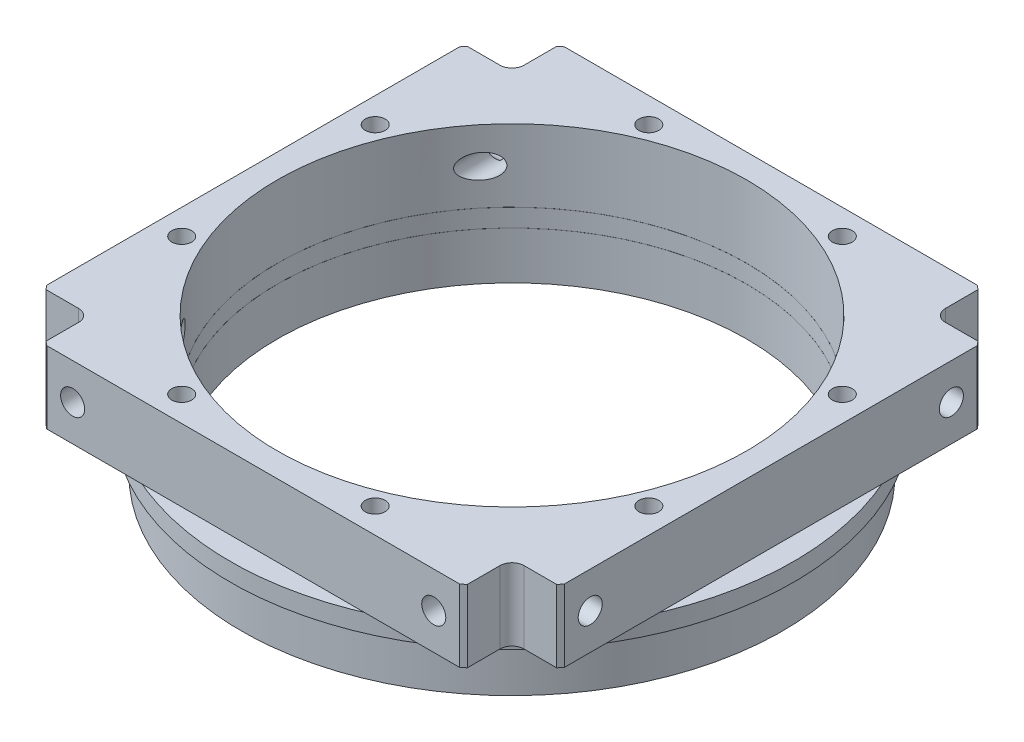
from build123d import *

# Parameters (mm, degrees)
SKETCH_2_OUTSIDE_W          = 143.448
SKETCH_2_OUTSIDE_H          = 143.448
SKETCH_2_OUTSIDE_W_2        = 86
SKETCH_2_OUTSIDE_H_2        = 86
CUT_EXTRUDE_1_DEPTH         = 12
SKETCH_4_R                  = 2
CUT_EXTRUDE_3_DEPTH         = 104.820470043
SKETCH_5_R                  = 2
CUT_EXTRUDE_4_DEPTH         = 12
CUT_EXTRUDE_START           = -74
SKETCH_5_2_R                = 2
CUT_EXTRUDE_5_DEPTH         = 12
SKETCH_6_R                  = 1.65
CUT_EXTRUDE_6_DEPTH         = 100
SKETCH_10_R                 = 2.1
CUT_EXTRUDE_8_DEPTH         = 10.9
PATTERN_CIRCULAR_1_COUNT    = 8
CUT_EXTRUDE_7_DEPTH         = 20
CUT_EXTRUDE_3262_DEPTH      = 71.034919894
CUT_EXTRUDE_3262_DEPTH_BACK = 71.034919894
SKETCH_11_W                 = 136.197392648
SKETCH_11_H                 = 0.01


with BuildPart() as part:
    # 草图1 → 旋转1 (revolve)
    with BuildSketch(Plane.XY, mode=Mode.PRIVATE) as revolve_1_sk:
        Polygon((-39, 0), (-45, 0), (-45, 7.9), (-46.8, 7.9), (-46.8, 10.9), (-55, 10.9), (-55, 22.9), (-39, 22.9), align=None)
    revolve(revolve_1_sk.sketch.rotate(Axis((0, 0, 0), (0, 1, 0)), 270), axis=Axis((0, 0, 0), (0, 1, 0)))

    # 草图2 outside → 切除-拉伸1 (cut)
    with BuildSketch(Plane(origin=(0, 22.9, 0), x_dir=(1, 0, 0), z_dir=(0, 1, 0))):
        Rectangle(SKETCH_2_OUTSIDE_W, SKETCH_2_OUTSIDE_H)
        Rectangle(SKETCH_2_OUTSIDE_W_2, SKETCH_2_OUTSIDE_H_2, mode=Mode.SUBTRACT)
    extrude(amount=-CUT_EXTRUDE_1_DEPTH, mode=Mode.SUBTRACT)

    # 草图4 → 切除-拉伸3 (cut, through all)
    with BuildSketch(Plane.XY.offset(43)):
        with Locations((-30, 16.9)):
            Circle(SKETCH_4_R)
        with Locations((30, 16.9)):
            Circle(SKETCH_4_R)
    extrude(amount=-CUT_EXTRUDE_3_DEPTH, mode=Mode.SUBTRACT)

    # 草图5 → 切除-拉伸4 (cut)
    with BuildSketch(Plane.ZY.offset(43)):
        with Locations((-30, 16.9)):
            Circle(SKETCH_5_R)
        with Locations((30, 16.9)):
            Circle(SKETCH_5_R)
    extrude(amount=-CUT_EXTRUDE_4_DEPTH, mode=Mode.SUBTRACT)

    # 草图5<2> → 切除-拉伸5 (cut)
    with BuildSketch(Plane.ZY.offset(43).offset(CUT_EXTRUDE_START)):
        with Locations((-30, 16.9)):
            Circle(SKETCH_5_2_R)
        with Locations((30, 16.9)):
            Circle(SKETCH_5_2_R)
    extrude(amount=-CUT_EXTRUDE_5_DEPTH, mode=Mode.SUBTRACT)

    # 草图6 → 切除-拉伸6 (cut)
    with BuildSketch(Plane.XZ):
        with Locations(Location((-16.072704159, -38.802940365, 0), (0, 0, 270))):
            Circle(SKETCH_6_R)
    cut_extrude_6 = extrude(amount=-CUT_EXTRUDE_6_DEPTH, mode=Mode.SUBTRACT)

    # 草图10 → 切除-拉伸8 (cut)
    with BuildSketch(Plane.XZ):
        with Locations(Location((-16.072704159, -38.802940365, 0), (0, 0, 270))):
            Circle(SKETCH_10_R)
    cut_extrude_8 = extrude(amount=-CUT_EXTRUDE_8_DEPTH, mode=Mode.SUBTRACT)

    # 阵列(圆周)1: 切除-拉伸6, 切除-拉伸8 ×8 about axis
    pattern_circular_1_axis = Axis((0, 0, 0), (0, 1, 0))
    add([cut_extrude_6.rotate(pattern_circular_1_axis, i * 360 / PATTERN_CIRCULAR_1_COUNT) for i in range(1, PATTERN_CIRCULAR_1_COUNT)], mode=Mode.SUBTRACT)
    add([cut_extrude_8.rotate(pattern_circular_1_axis, i * 360 / PATTERN_CIRCULAR_1_COUNT) for i in range(1, PATTERN_CIRCULAR_1_COUNT)], mode=Mode.SUBTRACT)

    # 草图7 → 切除-拉伸7 (cut)
    with BuildSketch(Plane(origin=(0, 22.9, 0), x_dir=(1, 0, 0), z_dir=(0, 1, 0))):
        with BuildLine():
            Line((-37, 35), (-53, 35))
            ThreePointArc((-53, 35), (-54.414213562, 35.585786438), (-55, 37))
            Line((-55, 37), (-55, 53))
            ThreePointArc((-55, 53), (-54.414213562, 54.414213562), (-53, 55))
            Line((-53, 55), (-37, 55))
            ThreePointArc((-37, 55), (-35.585786438, 54.414213562), (-35, 53))
            Line((-35, 53), (-35, 37))
            ThreePointArc((-35, 37), (-35.585786438, 35.585786438), (-37, 35))
        make_face()
        with BuildLine():
            Line((37, 35), (53, 35))
            ThreePointArc((53, 35), (54.414213562, 35.585786438), (55, 37))
            Line((55, 37), (55, 53))
            ThreePointArc((55, 53), (54.414213562, 54.414213562), (53, 55))
            Line((53, 55), (37, 55))
            ThreePointArc((37, 55), (35.585786438, 54.414213562), (35, 53))
            Line((35, 53), (35, 37))
            ThreePointArc((35, 37), (35.585786438, 35.585786438), (37, 35))
        make_face()
        with BuildLine():
            Line((37, -35), (53, -35))
            ThreePointArc((53, -35), (54.414213562, -35.585786438), (55, -37))
            Line((55, -37), (55, -53))
            ThreePointArc((55, -53), (54.414213562, -54.414213562), (53, -55))
            Line((53, -55), (37, -55))
            ThreePointArc((37, -55), (35.585786438, -54.414213562), (35, -53))
            Line((35, -53), (35, -37))
            ThreePointArc((35, -37), (35.585786438, -35.585786438), (37, -35))
        make_face()
        with BuildLine():
            Line((-37, -35), (-53, -35))
            ThreePointArc((-53, -35), (-54.414213562, -35.585786438), (-55, -37))
            Line((-55, -37), (-55, -53))
            ThreePointArc((-55, -53), (-54.414213562, -54.414213562), (-53, -55))
            Line((-53, -55), (-37, -55))
            ThreePointArc((-37, -55), (-35.585786438, -54.414213562), (-35, -53))
            Line((-35, -53), (-35, -37))
            ThreePointArc((-35, -37), (-35.585786438, -35.585786438), (-37, -35))
        make_face()
    extrude(amount=-CUT_EXTRUDE_7_DEPTH, mode=Mode.SUBTRACT)

    # 草图11 → Cut-Extrude 3262 (cut, two sides: drawn at the far end of the back side and taken through both)
    with BuildSketch(Plane(origin=(0, 0, 0), x_dir=(0, 0, -1), z_dir=(1, 0, 0)).offset(-CUT_EXTRUDE_3262_DEPTH_BACK)):
        with Locations((-5.996836933, 7.895)):
            Rectangle(SKETCH_11_W, SKETCH_11_H)
        with Locations((-5.996836933, 10.895)):
            Rectangle(SKETCH_11_W, SKETCH_11_H)
    extrude(amount=CUT_EXTRUDE_3262_DEPTH + CUT_EXTRUDE_3262_DEPTH_BACK, mode=Mode.SUBTRACT)


with BuildPart() as cut_extrude_3262_piece_1:
    # of the separate pieces the step leaves, piece 1, a body of its own (cut_extrude_3262_pieces)
    add(part.part.solids().sort_by_distance((40.452940365, 10.9, -16.072704159))[0])


with BuildPart() as cut_extrude_3262_piece_2:
    # of the separate pieces the step leaves, piece 2, a body of its own (cut_extrude_3262_pieces)
    add(part.part.solids().sort_by_distance((0, 0, -45))[0])


with BuildPart() as cut_extrude_3262_piece_3:
    # of the separate pieces the step leaves, piece 3, a body of its own (cut_extrude_3262_pieces)
    add(part.part.solids().sort_by_distance((0, 7.9, -46.8))[0])


solid = Compound([cut_extrude_3262_piece_1.part, cut_extrude_3262_piece_2.part, cut_extrude_3262_piece_3.part])
